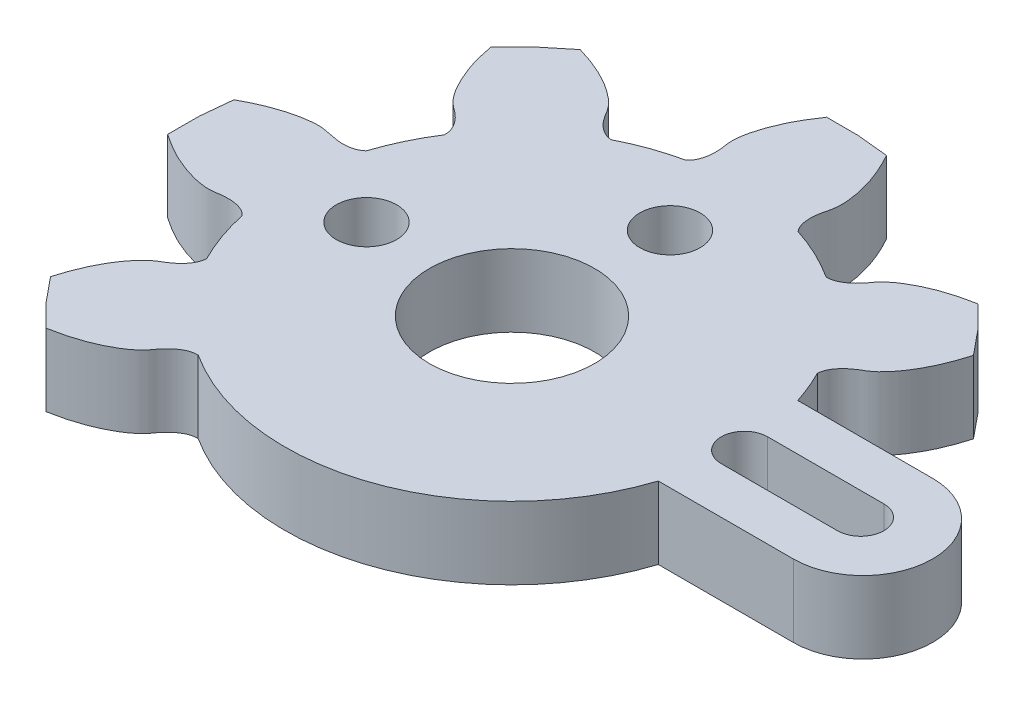
from build123d import *

# Parameters (mm, degrees)
SKETCH1_R           = 3.621001495
SKETCH1_R_2         = 1.32485
BOSS_EXTRUDE8_DEPTH = 3.175


with BuildPart() as part:
    # Sketch1 → Boss-Extrude8 (new body)
    with BuildSketch(Plane(origin=(0, 0, 0), x_dir=(1, 0, 0), z_dir=(0, 1, 0))):
        with BuildLine():
            Line((15.40195, -3.06005), (9.479044209, -3.06005))
            ThreePointArc((9.479044209, -3.06005), (3.349061232, -9.380830133), (-5.397926317, -8.371294798))
            add(Edge.make_bspline(
                [(-5.39885, -8.37085), (-5.398388066, -8.371072444), (-5.397926317, -8.371294798)],
                knots=[0.982532751, 0.982532751, 0.982532751, 0.982534494, 0.982534494, 0.982534494], degree=2))
            add(Edge.make_bspline(
                [(-9.76365, -10.68465), (-9.66975, -10.666225), (-9.57585, -10.6478), (-9.48195, -10.629375), (-9.461309709, -10.625324975), (-9.420029127, -10.617224924), (-9.358357661, -10.603714532), (-9.317485887, -10.593754844), (-9.29705, -10.588775), (-9.236383333, -10.573991667), (-9.175716667, -10.559208333), (-9.11505, -10.544425), (-9.09505359, -10.539552248), (-9.055060769, -10.529806745), (-8.995386219, -10.513820435), (-8.955895406, -10.502206812), (-8.93615, -10.4964), (-8.87755, -10.479166667), (-8.81895, -10.461933333), (-8.76035, -10.4447), (-8.741044573, -10.439022579), (-8.70243372, -10.427667738), (-8.644911698, -10.40922259), (-8.606920566, -10.395940863), (-8.587925, -10.3893), (-8.531575, -10.3696), (-8.475225, -10.3499), (-8.418875, -10.3302), (-8.400307112, -10.323708653), (-8.363171337, -10.31072596), (-8.307945222, -10.289819151), (-8.271548407, -10.274889717), (-8.25335, -10.267425), (-8.19935, -10.245275), (-8.14535, -10.223125), (-8.09135, -10.200975), (-8.07357074, -10.193682211), (-8.038012219, -10.179096633), (-7.985260366, -10.15572195), (-7.950603455, -10.139107317), (-7.933275, -10.1308), (-7.881891667, -10.106166667), (-7.830508333, -10.081533333), (-7.779125, -10.0569), (-7.762209538, -10.048790674), (-7.728378614, -10.032572021), (-7.678342979, -10.006692624), (-7.64559766, -9.988380875), (-7.629225, -9.979225), (-7.580675, -9.952075), (-7.532125, -9.924925), (-7.483575, -9.897775), (-7.467600223, -9.888841628), (-7.435650668, -9.870974884), (-7.388629916, -9.842479544), (-7.358059972, -9.822343181), (-7.342775, -9.812275), (-7.297458333, -9.782425), (-7.252141667, -9.752575), (-7.206825, -9.722725), (-7.191929518, -9.712913375), (-7.162138555, -9.693290126), (-7.118658875, -9.661920653), (-7.090719625, -9.639740218), (-7.07675, -9.62865), (-7.03535, -9.595783333), (-6.99395, -9.562916667), (-6.95255, -9.53005), (-6.938979405, -9.519276564), (-6.911838214, -9.497729693), (-6.873312582, -9.462407671), (-6.849654194, -9.43708589), (-6.837825, -9.424425), (-6.802741667, -9.386875), (-6.767658333, -9.349325), (-6.732575, -9.311775), (-6.720947754, -9.299330256), (-6.697693261, -9.274440768), (-6.66504846, -9.234878404), (-6.645066153, -9.207292801), (-6.635075, -9.1935), (-6.605158333, -9.1522), (-6.575241667, -9.1109), (-6.545325, -9.0696), (-6.535335739, -9.055809811), (-6.515357216, -9.028229432), (-6.482944791, -8.988528925), (-6.459948264, -8.963409642), (-6.44845, -8.95085), (-6.413783333, -8.912983333), (-6.379116667, -8.875116667), (-6.34445, -8.83725), (-6.335737, -8.827732723), (-6.318311001, -8.80869817), (-6.292038918, -8.780084789), (-6.272746306, -8.76294493), (-6.2631, -8.754375), (-6.243533333, -8.736991667), (-6.223966667, -8.719608333), (-6.2044, -8.702225), (-6.197807751, -8.696368343), (-6.184623253, -8.684655028), (-6.164052786, -8.667944781), (-6.149917595, -8.65739826), (-6.14285, -8.652125), (-6.121383333, -8.636108333), (-6.099916667, -8.620091667), (-6.07845, -8.604075), (-6.071148256, -8.598627038), (-6.056544769, -8.587731113), (-6.033747844, -8.572533046), (-6.018132615, -8.563144349), (-6.010325, -8.55845), (-5.986375, -8.54405), (-5.962425, -8.52965), (-5.938475, -8.51525), (-5.932394003, -8.511593785), (-5.92023201, -8.504281355), (-5.901900883, -8.493339339), (-5.889100294, -8.487213113), (-5.8827, -8.48415), (-5.869466667, -8.477816667), (-5.856233333, -8.471483333), (-5.843, -8.46515), (-5.838483389, -8.462988398), (-5.829450167, -8.458665193), (-5.815647927, -8.452689345), (-5.806332642, -8.449013115), (-5.801675, -8.447175), (-5.787358333, -8.441525), (-5.773041667, -8.435875), (-5.758725, -8.430225), (-5.753783147, -8.428274723), (-5.743899441, -8.424374168), (-5.728768726, -8.419261803), (-5.718572909, -8.416270601), (-5.713475, -8.414775), (-5.697625, -8.410125), (-5.681775, -8.405475), (-5.665925, -8.400825), (-5.660342654, -8.399187277), (-5.649177962, -8.395911831), (-5.632104617, -8.39205124), (-5.620651539, -8.390000413), (-5.614925, -8.388975), (-5.596775, -8.385725), (-5.578625, -8.382475), (-5.560475, -8.379225), (-5.553792818, -8.378028466), (-5.540428454, -8.375635398), (-5.520008491, -8.374005169), (-5.506436164, -8.373651723), (-5.49965, -8.373475), (-5.46605, -8.3726), (-5.43245, -8.371725), (-5.39885, -8.37085)],
                knots=[0, 0, 0, 0, 0.056502834, 0.056502834, 0.056502834, 0.068922802, 0.081342769, 0.093762737, 0.093762737, 0.093762737, 0.130633073, 0.130633073, 0.130633073, 0.142785947, 0.154938821, 0.167091696, 0.167091696, 0.167091696, 0.20315874, 0.20315874, 0.20315874, 0.215040816, 0.226922892, 0.238804968, 0.238804968, 0.238804968, 0.27405293, 0.27405293, 0.27405293, 0.285667485, 0.297282041, 0.308896596, 0.308896596, 0.308896596, 0.343360381, 0.343360381, 0.343360381, 0.354707429, 0.366054477, 0.377401525, 0.377401525, 0.377401525, 0.411048445, 0.411048445, 0.411048445, 0.422125056, 0.433201667, 0.444278278, 0.444278278, 0.444278278, 0.477123856, 0.477123856, 0.477123856, 0.487931287, 0.498738719, 0.50954615, 0.50954615, 0.50954615, 0.541587868, 0.541587868, 0.541587868, 0.552119906, 0.562651943, 0.57318398, 0.57318398, 0.57318398, 0.604396439, 0.604396439, 0.604396439, 0.614627638, 0.624858837, 0.635090036, 0.635090036, 0.635090036, 0.665433995, 0.665433995, 0.665433995, 0.675490527, 0.68554706, 0.695603592, 0.695603592, 0.695603592, 0.725716025, 0.725716025, 0.725716025, 0.735770653, 0.745825281, 0.755879909, 0.755879909, 0.755879909, 0.78619409, 0.78619409, 0.78619409, 0.793813151, 0.801432212, 0.809051273, 0.809051273, 0.809051273, 0.824505855, 0.824505855, 0.824505855, 0.829712692, 0.834919529, 0.840126366, 0.840126366, 0.840126366, 0.855941284, 0.855941284, 0.855941284, 0.861320623, 0.866699962, 0.872079301, 0.872079301, 0.872079301, 0.88858052, 0.88858052, 0.88858052, 0.892770243, 0.896959966, 0.901149689, 0.901149689, 0.901149689, 0.909812415, 0.909812415, 0.909812415, 0.912769053, 0.91572569, 0.918682327, 0.918682327, 0.918682327, 0.927770442, 0.927770442, 0.927770442, 0.930907494, 0.934044547, 0.937181599, 0.937181599, 0.937181599, 0.946935064, 0.946935064, 0.946935064, 0.95037022, 0.953805376, 0.957240532, 0.957240532, 0.957240532, 0.968128099, 0.968128099, 0.968128099, 0.972136512, 0.976144926, 0.980153339, 0.980153339, 0.980153339, 1, 1, 1, 1], degree=3))
            Line((-9.76365, -10.68465), (-10.74155, -9.70115))
            Line((-10.74155, -9.70115), (-11.62055, -8.62865))
            add(Edge.make_bspline(
                [(-8.875894683, -4.520473283), (-8.87995, -4.554525), (-8.88425, -4.5879), (-8.88855, -4.621275), (-8.889417644, -4.62800933), (-8.891152932, -4.641477991), (-8.894833157, -4.66163045), (-8.898544386, -4.674693483), (-8.9004, -4.681225), (-8.905433333, -4.698941667), (-8.910466667, -4.716658333), (-8.9155, -4.734375), (-8.917089228, -4.739968872), (-8.920267684, -4.751156617), (-8.925827695, -4.767749798), (-8.930225898, -4.778516599), (-8.932425, -4.7839), (-8.938675, -4.7992), (-8.944925, -4.8145), (-8.951175, -4.8298), (-8.953185758, -4.834722336), (-8.957207274, -4.844567008), (-8.963841786, -4.859108956), (-8.968730595, -4.868552985), (-8.971175, -4.873275), (-8.978258333, -4.886958333), (-8.985341667, -4.900641667), (-8.992425, -4.914325), (-8.994726466, -4.918770891), (-8.999329398, -4.927662673), (-9.006690131, -4.940777083), (-9.011930044, -4.949309028), (-9.01455, -4.953575), (-9.022216667, -4.966058333), (-9.029883333, -4.978541667), (-9.03755, -4.991025), (-9.041261043, -4.997067546), (-9.048683129, -5.009152639), (-9.061395503, -5.026280419), (-9.069881834, -5.037643473), (-9.074125, -5.043325), (-9.090841667, -5.065708333), (-9.107558333, -5.088091667), (-9.124275, -5.110475), (-9.129726551, -5.117774535), (-9.140629654, -5.132373605), (-9.158063981, -5.153516152), (-9.17040466, -5.166922051), (-9.176575, -5.173625), (-9.194725, -5.193341667), (-9.212875, -5.213058333), (-9.231025, -5.232775), (-9.236997994, -5.239263569), (-9.248943981, -5.252240707), (-9.267657405, -5.271008071), (-9.280635802, -5.28295269), (-9.287125, -5.288925), (-9.306375, -5.306641667), (-9.325625, -5.324358333), (-9.344875, -5.342075), (-9.354366518, -5.350810484), (-9.373349555, -5.368281452), (-9.404488924, -5.3914928), (-9.425196308, -5.406880933), (-9.43555, -5.414575), (-9.47675, -5.445191667), (-9.51795, -5.475808333), (-9.55915, -5.506425), (-9.572818003, -5.516582007), (-9.600154008, -5.536896021), (-9.642939104, -5.565109828), (-9.672396368, -5.582203276), (-9.687125, -5.59075), (-9.731241667, -5.61635), (-9.775358333, -5.64195), (-9.819475, -5.66755), (-9.834207417, -5.676098921), (-9.863672251, -5.693196762), (-9.906346122, -5.721657481), (-9.933482041, -5.742252494), (-9.94705, -5.75255), (-9.987983333, -5.783616667), (-10.028916667, -5.814683333), (-10.06985, -5.84575), (-10.083652948, -5.856225853), (-10.111258845, -5.87717756), (-10.150311323, -5.911928124), (-10.174487108, -5.936759375), (-10.186575, -5.949175), (-10.223458333, -5.987058333), (-10.260341667, -6.024941667), (-10.297225, -6.062825), (-10.309669163, -6.075606556), (-10.33455749, -6.101169668), (-10.370180135, -6.14124456), (-10.392743378, -6.16888152), (-10.404025, -6.1827), (-10.438341667, -6.224733333), (-10.472658333, -6.266766667), (-10.506975, -6.3088), (-10.518549041, -6.322976655), (-10.541697123, -6.351329964), (-10.574818781, -6.395210772), (-10.595822927, -6.425186924), (-10.606325, -6.440175), (-10.638241667, -6.485725), (-10.670158333, -6.531275), (-10.702075, -6.576825), (-10.712838738, -6.592186513), (-10.734366215, -6.622909538), (-10.765177447, -6.670062206), (-10.784742482, -6.702070735), (-10.794525, -6.718075), (-10.824241667, -6.766691667), (-10.853958333, -6.815308333), (-10.883675, -6.863925), (-10.893695201, -6.880318116), (-10.913735602, -6.913104348), (-10.942341843, -6.963198589), (-10.960463948, -6.997082863), (-10.969525, -7.014025), (-10.997041667, -7.065475), (-11.024558333, -7.116925), (-11.052075, -7.168375), (-11.061352149, -7.185721189), (-11.079906446, -7.220413566), (-11.10631741, -7.273233713), (-11.123005803, -7.308861238), (-11.13135, -7.326675), (-11.156683333, -7.380758333), (-11.182016667, -7.434841667), (-11.20735, -7.488925), (-11.21588754, -7.507151525), (-11.232962621, -7.543604576), (-11.257171761, -7.598960897), (-11.272407254, -7.636220299), (-11.280025, -7.65485), (-11.303141667, -7.711383333), (-11.326258333, -7.767916667), (-11.349375, -7.82445), (-11.35716434, -7.843499344), (-11.372743019, -7.881598031), (-11.394716866, -7.93933363), (-11.408472289, -7.978127877), (-11.41535, -7.997525), (-11.436216667, -8.056375), (-11.457083333, -8.115225), (-11.47795, -8.174075), (-11.484979805, -8.19390107), (-11.499039414, -8.233553211), (-11.518728382, -8.293544353), (-11.530959461, -8.333798118), (-11.537075, -8.353925), (-11.5649, -8.4455), (-11.592725, -8.537075), (-11.62055, -8.62865)],
                knots=[0, 0, 0, 0, 0.019869495, 0.019869495, 0.019869495, 0.023878716, 0.027887937, 0.031897157, 0.031897157, 0.031897157, 0.042772125, 0.042772125, 0.042772125, 0.046205794, 0.049639464, 0.053073133, 0.053073133, 0.053073133, 0.062831861, 0.062831861, 0.062831861, 0.065971451, 0.069111042, 0.072250633, 0.072250633, 0.072250633, 0.081348457, 0.081348457, 0.081348457, 0.084304458, 0.087260458, 0.090216458, 0.090216458, 0.090216458, 0.098866476, 0.098866476, 0.098866476, 0.103053509, 0.107240543, 0.111427576, 0.111427576, 0.111427576, 0.127923099, 0.127923099, 0.127923099, 0.133302532, 0.138681965, 0.144061399, 0.144061399, 0.144061399, 0.159884954, 0.159884954, 0.159884954, 0.165092337, 0.17029972, 0.175507102, 0.175507102, 0.175507102, 0.190954637, 0.190954637, 0.190954637, 0.19857129, 0.206187942, 0.213804595, 0.213804595, 0.213804595, 0.244113211, 0.244113211, 0.244113211, 0.254168023, 0.264222835, 0.274277647, 0.274277647, 0.274277647, 0.304394822, 0.304394822, 0.304394822, 0.314452218, 0.324509614, 0.334567011, 0.334567011, 0.334567011, 0.364909285, 0.364909285, 0.364909285, 0.37514087, 0.385372454, 0.395604038, 0.395604038, 0.395604038, 0.426823289, 0.426823289, 0.426823289, 0.437356433, 0.447889577, 0.458422721, 0.458422721, 0.458422721, 0.490462652, 0.490462652, 0.490462652, 0.501268815, 0.512074978, 0.522881141, 0.522881141, 0.522881141, 0.555721961, 0.555721961, 0.555721961, 0.566797365, 0.57787277, 0.588948175, 0.588948175, 0.588948175, 0.622592285, 0.622592285, 0.622592285, 0.633936786, 0.645281287, 0.656625788, 0.656625788, 0.656625788, 0.691076847, 0.691076847, 0.691076847, 0.702691901, 0.714306956, 0.725922011, 0.725922011, 0.725922011, 0.761185807, 0.761185807, 0.761185807, 0.773069995, 0.784954182, 0.796838369, 0.796838369, 0.796838369, 0.832901897, 0.832901897, 0.832901897, 0.845053781, 0.857205665, 0.86935755, 0.86935755, 0.86935755, 0.90622582, 0.90622582, 0.90622582, 0.918646431, 0.931067041, 0.943487651, 0.943487651, 0.943487651, 1, 1, 1, 1], degree=3))
            ThreePointArc((-8.875894683, -4.520473283), (-9.384335902, -3.339225181), (-9.73665, -2.10145))
            add(Edge.make_bspline(
                [(-14.45905, -0.65115), (-14.37965, -0.70455), (-14.30025, -0.75795), (-14.22085, -0.81135), (-14.203394477, -0.823089608), (-14.168483432, -0.846568825), (-14.115322064, -0.880637287), (-14.079374021, -0.902495762), (-14.0614, -0.913425), (-14.008033333, -0.945875), (-13.954666667, -0.978325), (-13.9013, -1.010775), (-13.883715092, -1.021467635), (-13.848545276, -1.042852904), (-13.795040106, -1.073732233), (-13.758896702, -1.093427411), (-13.740825, -1.103275), (-13.687208333, -1.132491667), (-13.633591667, -1.161708333), (-13.579975, -1.190925), (-13.562302674, -1.200554962), (-13.526958023, -1.219814885), (-13.473231796, -1.247444376), (-13.436977265, -1.264931459), (-13.41885, -1.273675), (-13.36505, -1.299625), (-13.31125, -1.325575), (-13.25745, -1.351525), (-13.239731987, -1.360071142), (-13.204295962, -1.377163425), (-13.15045571, -1.401431733), (-13.114151903, -1.416593911), (-13.096, -1.424175), (-13.042166667, -1.446658333), (-12.988333333, -1.469141667), (-12.9345, -1.491625), (-12.916773161, -1.499028562), (-12.881319483, -1.513835687), (-12.827506655, -1.534597035), (-12.791268885, -1.547365678), (-12.77315, -1.55375), (-12.719416667, -1.572683333), (-12.665683333, -1.591616667), (-12.61195, -1.61055), (-12.594259204, -1.616783482), (-12.558877611, -1.629250445), (-12.505203027, -1.646333345), (-12.469101009, -1.656527782), (-12.45105, -1.661625), (-12.397516667, -1.676741667), (-12.343983333, -1.691858333), (-12.29045, -1.706975), (-12.272835198, -1.711949043), (-12.237605594, -1.721897128), (-12.184206346, -1.73499493), (-12.148352115, -1.742381643), (-12.130425, -1.746075), (-12.077275, -1.757025), (-12.024125, -1.767975), (-11.970975, -1.778925), (-11.953504341, -1.782524317), (-11.918563023, -1.789722952), (-11.865636121, -1.798300758), (-11.830195374, -1.802383586), (-11.812475, -1.804425), (-11.759958333, -1.810475), (-11.707441667, -1.816525), (-11.654925, -1.822575), (-11.637710255, -1.824558165), (-11.603280765, -1.828524495), (-11.551055081, -1.830786904), (-11.51641836, -1.829595635), (-11.4991, -1.829), (-11.447733333, -1.827233333), (-11.396366667, -1.825466667), (-11.345, -1.8237), (-11.327976022, -1.82311449), (-11.293928067, -1.82194347), (-11.242864274, -1.817048901), (-11.209221425, -1.811682967), (-11.1924, -1.809), (-11.142033333, -1.800966667), (-11.091666667, -1.792933333), (-11.0413, -1.7849), (-11.024484131, -1.782217919), (-10.990852393, -1.776853757), (-10.939860428, -1.77170571), (-10.905836809, -1.770201903), (-10.888825, -1.76945), (-10.837541667, -1.767183333), (-10.786258333, -1.764916667), (-10.734975, -1.76265), (-10.722089804, -1.762080489), (-10.696319413, -1.760941466), (-10.657525274, -1.759281162), (-10.631775091, -1.760810387), (-10.6189, -1.761575), (-10.5928, -1.763125), (-10.5667, -1.764675), (-10.5406, -1.766225), (-10.531794763, -1.766747916), (-10.51418429, -1.767793749), (-10.487815672, -1.770518547), (-10.470355224, -1.773039516), (-10.461625, -1.7743), (-10.435075, -1.778133333), (-10.408525, -1.781966667), (-10.381975, -1.7858), (-10.372956183, -1.787102152), (-10.354918548, -1.789706456), (-10.328042911, -1.795083283), (-10.310364304, -1.799511094), (-10.301525, -1.801725), (-10.274441667, -1.808508333), (-10.247358333, -1.815291667), (-10.220275, -1.822075), (-10.213395854, -1.823797961), (-10.199637563, -1.827243884), (-10.178961886, -1.832490136), (-10.165570629, -1.837163379), (-10.158875, -1.8395), (-10.145025, -1.844333333), (-10.131175, -1.849166667), (-10.117325, -1.854), (-10.11259695, -1.855649981), (-10.103140851, -1.858949944), (-10.08914779, -1.864474812), (-10.07996593, -1.868474937), (-10.075375, -1.870475), (-10.061258333, -1.876625), (-10.047141667, -1.882775), (-10.033025, -1.888925), (-10.028152778, -1.891047609), (-10.018408333, -1.895292828), (-10.004093681, -1.902384772), (-9.99476456, -1.907478257), (-9.9901, -1.910025), (-9.9756, -1.917941667), (-9.9611, -1.925858333), (-9.9466, -1.933775), (-9.94149644, -1.936561426), (-9.931289321, -1.942134279), (-9.916499605, -1.951484217), (-9.906966535, -1.958144739), (-9.9022, -1.961475), (-9.8871, -1.972025), (-9.872, -1.982575), (-9.8569, -1.993125), (-9.851336658, -1.997011971), (-9.840209973, -2.004785913), (-9.824627688, -2.018069507), (-9.814775896, -2.027406502), (-9.80985, -2.032075), (-9.78545, -2.0552), (-9.76105, -2.078325), (-9.73665, -2.10145)],
                knots=[0, 0, 0, 0, 0.056501117, 0.056501117, 0.056501117, 0.068922484, 0.081343851, 0.093765217, 0.093765217, 0.093765217, 0.130645498, 0.130645498, 0.130645498, 0.142797959, 0.15495042, 0.167102881, 0.167102881, 0.167102881, 0.203157839, 0.203157839, 0.203157839, 0.215041736, 0.226925633, 0.23880953, 0.23880953, 0.23880953, 0.274079808, 0.274079808, 0.274079808, 0.285695407, 0.297311005, 0.308926604, 0.308926604, 0.308926604, 0.343375135, 0.343375135, 0.343375135, 0.354718731, 0.366062326, 0.377405922, 0.377405922, 0.377405922, 0.411046469, 0.411046469, 0.411046469, 0.422122053, 0.433197638, 0.444273222, 0.444273222, 0.444273222, 0.477119748, 0.477119748, 0.477119748, 0.487927688, 0.498735628, 0.509543569, 0.509543569, 0.509543569, 0.541586761, 0.541586761, 0.541586761, 0.552119512, 0.562652263, 0.573185013, 0.573185013, 0.573185013, 0.60440021, 0.60440021, 0.60440021, 0.614632422, 0.624864634, 0.635096846, 0.635096846, 0.635096846, 0.665445828, 0.665445828, 0.665445828, 0.67550411, 0.685562391, 0.695620673, 0.695620673, 0.695620673, 0.725737154, 0.725737154, 0.725737154, 0.735792114, 0.745847074, 0.755902033, 0.755902033, 0.755902033, 0.786213439, 0.786213439, 0.786213439, 0.793829332, 0.801445225, 0.809061118, 0.809061118, 0.809061118, 0.824499829, 0.824499829, 0.824499829, 0.829708316, 0.834916803, 0.840125289, 0.840125289, 0.840125289, 0.855965126, 0.855965126, 0.855965126, 0.861345788, 0.866726451, 0.872107114, 0.872107114, 0.872107114, 0.888593286, 0.888593286, 0.888593286, 0.892780761, 0.896968236, 0.90115571, 0.90115571, 0.90115571, 0.90981756, 0.90981756, 0.90981756, 0.912774502, 0.915731445, 0.918688387, 0.918688387, 0.918688387, 0.9277807, 0.9277807, 0.9277807, 0.930918818, 0.934056936, 0.937195055, 0.937195055, 0.937195055, 0.946950039, 0.946950039, 0.946950039, 0.950383498, 0.953816956, 0.957250415, 0.957250415, 0.957250415, 0.968127335, 0.968127335, 0.968127335, 0.972134755, 0.976142174, 0.980149594, 0.980149594, 0.980149594, 1, 1, 1, 1], degree=3))
            Line((-14.45905, -0.65115), (-14.45515, 0.73555))
            Line((-14.45515, 0.73555), (-14.31835, 2.11575))
            add(Edge.make_bspline(
                [(-9.47275279, 3.079470686), (-9.499575, 3.058525), (-9.5262, 3.038), (-9.552825, 3.017475), (-9.558201134, 3.013330581), (-9.568953403, 3.005041743), (-9.585808694, 2.993408616), (-9.597669565, 2.986802872), (-9.6036, 2.9835), (-9.6197, 2.974533333), (-9.6358, 2.965566667), (-9.6519, 2.9566), (-9.656982608, 2.953769313), (-9.667147825, 2.94810794), (-9.682825385, 2.940313965), (-9.693558462, 2.935821322), (-9.698925, 2.933575), (-9.714175, 2.927191667), (-9.729425, 2.920808333), (-9.744675, 2.914425), (-9.749577525, 2.912372905), (-9.759382574, 2.908268715), (-9.774343121, 2.902670637), (-9.784464374, 2.899423546), (-9.789525, 2.8978), (-9.804175, 2.8931), (-9.818825, 2.8884), (-9.833475, 2.8837), (-9.838241417, 2.882170842), (-9.847774251, 2.879112527), (-9.862245855, 2.875022488), (-9.871981952, 2.872690829), (-9.87685, 2.871525), (-9.891116667, 2.868108333), (-9.905383333, 2.864691667), (-9.91965, 2.861275), (-9.926549058, 2.859622772), (-9.940347174, 2.856318317), (-9.961460041, 2.853209675), (-9.975503347, 2.851186558), (-9.982525, 2.850175), (-10.010175, 2.846191667), (-10.037825, 2.842208333), (-10.065475, 2.838225), (-10.074494103, 2.836925684), (-10.09253231, 2.834327051), (-10.119812799, 2.831705712), (-10.138020933, 2.830935237), (-10.147125, 2.83055), (-10.173908333, 2.829416667), (-10.200691667, 2.828283333), (-10.227475, 2.82715), (-10.236283786, 2.826777257), (-10.253901357, 2.826031772), (-10.280398425, 2.825986947), (-10.298016142, 2.826728982), (-10.306825, 2.8271), (-10.332941667, 2.8282), (-10.359058333, 2.8293), (-10.385175, 2.8304), (-10.398061977, 2.830942783), (-10.42383593, 2.832028348), (-10.462264313, 2.837610268), (-10.487788104, 2.841353423), (-10.50055, 2.843225), (-10.55135, 2.850675), (-10.60215, 2.858125), (-10.65295, 2.865575), (-10.669799441, 2.86804603), (-10.703498322, 2.872988091), (-10.753708799, 2.883294584), (-10.7866196, 2.892064861), (-10.803075, 2.89645), (-10.852358333, 2.909583333), (-10.901641667, 2.922716667), (-10.950925, 2.93585), (-10.967383318, 2.940235916), (-11.000299955, 2.949007749), (-11.050598624, 2.959073052), (-11.084349541, 2.963691017), (-11.101225, 2.966), (-11.152141667, 2.972966667), (-11.203058333, 2.979933333), (-11.253975, 2.9869), (-11.271143929, 2.989249137), (-11.305481787, 2.99394741), (-11.35766766, 2.996996903), (-11.392322553, 2.996548968), (-11.40965, 2.996325), (-11.462516667, 2.995641667), (-11.515383333, 2.994958333), (-11.56825, 2.994275), (-11.586086477, 2.994044453), (-11.621759431, 2.993583359), (-11.675285043, 2.990432825), (-11.710778348, 2.986827608), (-11.728525, 2.985025), (-11.782508333, 2.979541667), (-11.836491667, 2.974058333), (-11.890475, 2.968575), (-11.908680212, 2.966725814), (-11.945090636, 2.963027441), (-11.999530576, 2.955419235), (-12.035576859, 2.949089745), (-12.0536, 2.945925), (-12.108366667, 2.936308333), (-12.163133333, 2.926691667), (-12.2179, 2.917075), (-12.236374347, 2.913831026), (-12.27332304, 2.907343079), (-12.328452438, 2.895788641), (-12.364917479, 2.886979547), (-12.38315, 2.882575), (-12.43855, 2.869191667), (-12.49395, 2.855808333), (-12.54935, 2.842425), (-12.568029735, 2.837912417), (-12.605389205, 2.82888725), (-12.661049299, 2.813687425), (-12.6978331, 2.802545808), (-12.716225, 2.796975), (-12.772075, 2.780058333), (-12.827925, 2.763141667), (-12.883775, 2.746225), (-12.902598938, 2.74052333), (-12.940246813, 2.72911999), (-12.996266796, 2.710456362), (-13.033255599, 2.697068787), (-13.05175, 2.690375), (-13.107883333, 2.670058333), (-13.164016667, 2.649741667), (-13.22015, 2.629425), (-13.239074472, 2.622575555), (-13.276923415, 2.608876665), (-13.333179405, 2.586846768), (-13.370293135, 2.571265589), (-13.38885, 2.563475), (-13.445183333, 2.539825), (-13.501516667, 2.516175), (-13.55785, 2.492525), (-13.576826936, 2.484558055), (-13.614780809, 2.468624166), (-13.671141253, 2.443322848), (-13.708297084, 2.425607616), (-13.726875, 2.41675), (-13.783225, 2.389883333), (-13.839575, 2.363016667), (-13.895925, 2.33615), (-13.914912623, 2.327097043), (-13.95288787, 2.308991128), (-14.009235442, 2.280507419), (-14.046361814, 2.26071914), (-14.064925, 2.250825), (-14.1494, 2.2058), (-14.233875, 2.160775), (-14.31835, 2.11575)],
                knots=[0, 0, 0, 0, 0.019850356, 0.019850356, 0.019850356, 0.02385855, 0.027866745, 0.031874939, 0.031874939, 0.031874939, 0.042756422, 0.042756422, 0.042756422, 0.046191597, 0.049626772, 0.053061947, 0.053061947, 0.053061947, 0.062823624, 0.062823624, 0.062823624, 0.065961779, 0.069099934, 0.072238089, 0.072238089, 0.072238089, 0.081322729, 0.081322729, 0.081322729, 0.084278441, 0.087234153, 0.090189865, 0.090189865, 0.090189865, 0.098852096, 0.098852096, 0.098852096, 0.103040968, 0.107229839, 0.111418711, 0.111418711, 0.111418711, 0.12791373, 0.12791373, 0.12791373, 0.13329421, 0.138674691, 0.144055171, 0.144055171, 0.144055171, 0.159884052, 0.159884052, 0.159884052, 0.165090022, 0.170295992, 0.175501962, 0.175501962, 0.175501962, 0.190936717, 0.190936717, 0.190936717, 0.198552824, 0.206168932, 0.213785039, 0.213785039, 0.213785039, 0.244101714, 0.244101714, 0.244101714, 0.254157207, 0.264212699, 0.274268192, 0.274268192, 0.274268192, 0.304384031, 0.304384031, 0.304384031, 0.314441307, 0.324498583, 0.334555858, 0.334555858, 0.334555858, 0.36490069, 0.36490069, 0.36490069, 0.375132866, 0.385365041, 0.395597217, 0.395597217, 0.395597217, 0.426815954, 0.426815954, 0.426815954, 0.437348721, 0.447881489, 0.458414256, 0.458414256, 0.458414256, 0.490453757, 0.490453757, 0.490453757, 0.501258683, 0.512063608, 0.522868534, 0.522868534, 0.522868534, 0.55570131, 0.55570131, 0.55570131, 0.566776735, 0.57785216, 0.588927584, 0.588927584, 0.588927584, 0.622580557, 0.622580557, 0.622580557, 0.633927644, 0.64527473, 0.656621817, 0.656621817, 0.656621817, 0.691079094, 0.691079094, 0.691079094, 0.702692731, 0.714306368, 0.725920005, 0.725920005, 0.725920005, 0.761169167, 0.761169167, 0.761169167, 0.773052869, 0.78493657, 0.796820271, 0.796820271, 0.796820271, 0.832895789, 0.832895789, 0.832895789, 0.845048501, 0.857201213, 0.869353926, 0.869353926, 0.869353926, 0.906215184, 0.906215184, 0.906215184, 0.918635905, 0.931056627, 0.943477349, 0.943477349, 0.943477349, 1, 1, 1, 1], degree=3))
            ThreePointArc((-9.47275279, 3.079470686), (-8.997092109, 4.274168774), (-8.371484108, 5.397632718))
            Line((-8.371484108, 5.397632718), (-8.37085, 5.39895))
            add(Edge.make_bspline(
                [(-10.68455, 9.76365), (-10.66615, 9.66975), (-10.64775, 9.57585), (-10.62935, 9.48195), (-10.625305496, 9.46130984), (-10.617216487, 9.420029519), (-10.603722787, 9.358358062), (-10.593774262, 9.317486021), (-10.5888, 9.29705), (-10.574033333, 9.236383333), (-10.559266667, 9.175716667), (-10.5445, 9.11505), (-10.539633363, 9.095056139), (-10.529900088, 9.055068418), (-10.513897752, 8.995408534), (-10.502249251, 8.955936178), (-10.496425, 8.9362), (-10.479141667, 8.877633333), (-10.461858333, 8.819066667), (-10.444575, 8.7605), (-10.438878962, 8.741198286), (-10.427486886, 8.702594857), (-10.40902376, 8.645075426), (-10.39575792, 8.607075142), (-10.389125, 8.588075), (-10.369441667, 8.531691667), (-10.349758333, 8.475308333), (-10.330075, 8.418925), (-10.323590254, 8.400349304), (-10.310620761, 8.363197912), (-10.28971449, 8.307953721), (-10.274771497, 8.27155124), (-10.2673, 8.25335), (-10.245133333, 8.19935), (-10.222966667, 8.14535), (-10.2008, 8.09135), (-10.193502514, 8.073572667), (-10.178907543, 8.038018001), (-10.155533236, 7.985266938), (-10.138927745, 7.950605646), (-10.130625, 7.933275), (-10.106008333, 7.881891667), (-10.081391667, 7.830508333), (-10.056775, 7.779125), (-10.048671754, 7.762210776), (-10.032465261, 7.728382329), (-10.006594324, 7.678354157), (-9.988281441, 7.645618052), (-9.979125, 7.62925), (-9.951975, 7.580716667), (-9.924825, 7.532183333), (-9.897675, 7.48365), (-9.888740451, 7.467678602), (-9.870871352, 7.435735805), (-9.842375626, 7.388723968), (-9.822241875, 7.358157989), (-9.812175, 7.342875), (-9.782325, 7.297558333), (-9.752475, 7.252241667), (-9.722625, 7.206925), (-9.712812137, 7.192027639), (-9.693186412, 7.162232916), (-9.661816636, 7.118745685), (-9.639638879, 7.090798562), (-9.62855, 7.076825), (-9.595683333, 7.035408333), (-9.562816667, 6.993991667), (-9.52995, 6.952575), (-9.519178055, 6.939000819), (-9.497634164, 6.911852458), (-9.462303061, 6.873324019), (-9.436967687, 6.849674673), (-9.4243, 6.83785), (-9.386733333, 6.802783333), (-9.349166667, 6.767716667), (-9.3116, 6.73265), (-9.299149927, 6.721028459), (-9.274249782, 6.697785378), (-9.234689719, 6.665142344), (-9.20711324, 6.645147448), (-9.193325, 6.63515), (-9.152041667, 6.605216667), (-9.110758333, 6.575283333), (-9.069475, 6.54535), (-9.05568795, 6.535353415), (-9.028113849, 6.515360244), (-8.988415371, 6.482940089), (-8.963288457, 6.459946696), (-8.950725, 6.44845), (-8.912841667, 6.413783333), (-8.874958333, 6.379116667), (-8.837075, 6.34445), (-8.827555814, 6.335739086), (-8.808517442, 6.318317259), (-8.779896004, 6.292051159), (-8.762765335, 6.272750386), (-8.7542, 6.2631), (-8.736833333, 6.243533333), (-8.719466667, 6.223966667), (-8.7021, 6.2044), (-8.696246483, 6.197804963), (-8.684539449, 6.184614888), (-8.66783035, 6.164044897), (-8.657276783, 6.149914966), (-8.652, 6.14285), (-8.635966667, 6.121383333), (-8.619933333, 6.099916667), (-8.6039, 6.07845), (-8.598449323, 6.071152212), (-8.587547968, 6.056556635), (-8.572356695, 6.033758261), (-8.562985565, 6.018136087), (-8.5583, 6.010325), (-8.543933333, 5.986375), (-8.529566667, 5.962425), (-8.5152, 5.938475), (-8.511551255, 5.932392347), (-8.504253765, 5.920227042), (-8.493334921, 5.901895923), (-8.487178307, 5.889115308), (-8.4841, 5.882725), (-8.477733333, 5.869508333), (-8.471366667, 5.856291667), (-8.465, 5.843075), (-8.462826451, 5.838562895), (-8.458479354, 5.829538686), (-8.452495939, 5.81573375), (-8.44883198, 5.80641125), (-8.447, 5.80175), (-8.441366667, 5.787416667), (-8.435733333, 5.773083333), (-8.4301, 5.75875), (-8.428155701, 5.753802967), (-8.424267103, 5.743908901), (-8.419153831, 5.728771941), (-8.416151277, 5.71857398), (-8.41465, 5.713475), (-8.409983333, 5.697625), (-8.405316667, 5.681775), (-8.40065, 5.665925), (-8.399007229, 5.660345446), (-8.395721687, 5.649186337), (-8.391879697, 5.632109064), (-8.389859899, 5.620653021), (-8.38885, 5.614925), (-8.38565, 5.596775), (-8.38245, 5.578625), (-8.37925, 5.560475), (-8.378071886, 5.553792883), (-8.375715657, 5.540428649), (-8.374095448, 5.520023225), (-8.373731816, 5.506457742), (-8.37355, 5.499675), (-8.37265, 5.4661), (-8.37175, 5.432525), (-8.37085, 5.39895)],
                knots=[0, 0, 0, 0, 0.056501366, 0.056501366, 0.056501366, 0.068920931, 0.081340497, 0.093760063, 0.093760063, 0.093760063, 0.130628966, 0.130628966, 0.130628966, 0.142779818, 0.15493067, 0.167081523, 0.167081523, 0.167081523, 0.203138905, 0.203138905, 0.203138905, 0.215022273, 0.226905642, 0.23878901, 0.23878901, 0.23878901, 0.274053164, 0.274053164, 0.274053164, 0.285671069, 0.297288974, 0.308906878, 0.308906878, 0.308906878, 0.343375236, 0.343375236, 0.343375236, 0.354722559, 0.366069883, 0.377417206, 0.377417206, 0.377417206, 0.411060691, 0.411060691, 0.411060691, 0.42213536, 0.433210029, 0.444284698, 0.444284698, 0.444284698, 0.477122484, 0.477122484, 0.477122484, 0.487928776, 0.498735067, 0.509541359, 0.509541359, 0.509541359, 0.541583855, 0.541583855, 0.541583855, 0.552117477, 0.562651099, 0.573184721, 0.573184721, 0.573184721, 0.604405646, 0.604405646, 0.604405646, 0.614638205, 0.624870764, 0.635103323, 0.635103323, 0.635103323, 0.665448493, 0.665448493, 0.665448493, 0.67550527, 0.685562047, 0.695618823, 0.695618823, 0.695618823, 0.725729793, 0.725729793, 0.725729793, 0.735785702, 0.745841612, 0.755897521, 0.755897521, 0.755897521, 0.786219697, 0.786219697, 0.786219697, 0.793838943, 0.801458189, 0.809077435, 0.809077435, 0.809077435, 0.824525858, 0.824525858, 0.824525858, 0.829732821, 0.834939785, 0.840146749, 0.840146749, 0.840146749, 0.855967937, 0.855967937, 0.855967937, 0.861346494, 0.866725051, 0.872103608, 0.872103608, 0.872103608, 0.888595095, 0.888595095, 0.888595095, 0.892783487, 0.896971879, 0.901160271, 0.901160271, 0.901160271, 0.909822856, 0.909822856, 0.909822856, 0.91278022, 0.915737583, 0.918694947, 0.918694947, 0.918694947, 0.927788833, 0.927788833, 0.927788833, 0.930927514, 0.934066194, 0.937204875, 0.937204875, 0.937204875, 0.946961353, 0.946961353, 0.946961353, 0.950395851, 0.953830349, 0.957264847, 0.957264847, 0.957264847, 0.968147514, 0.968147514, 0.968147514, 0.972154084, 0.976160654, 0.980167224, 0.980167224, 0.980167224, 1, 1, 1, 1], degree=3))
            Line((-10.68455, 9.76365), (-9.70105, 10.74145))
            Line((-9.70105, 10.74145), (-8.62845, 11.62065))
            add(Edge.make_bspline(
                [(-4.52115, 8.87555), (-4.554475, 8.87985), (-4.5878, 8.88415), (-4.621125, 8.88845), (-4.627857534, 8.889318714), (-4.641322601, 8.891056142), (-4.661468521, 8.894755292), (-4.67452284, 8.898485097), (-4.68105, 8.90035), (-4.698783333, 8.905416667), (-4.716516667, 8.910483333), (-4.73425, 8.91555), (-4.739845752, 8.917148786), (-4.751037256, 8.920346359), (-4.767637504, 8.925922673), (-4.778412501, 8.930324224), (-4.7838, 8.932525), (-4.7991, 8.938775), (-4.8144, 8.945025), (-4.8297, 8.951275), (-4.834618925, 8.953284365), (-4.844456775, 8.957303095), (-4.858990372, 8.963928436), (-4.868430124, 8.968809479), (-4.87315, 8.97125), (-4.886816667, 8.978316667), (-4.900483333, 8.985383333), (-4.91415, 8.99245), (-4.918596688, 8.994749263), (-4.927490064, 8.999347789), (-4.940610935, 9.006693235), (-4.949153645, 9.011914412), (-4.953425, 9.014525), (-4.965941667, 9.022175), (-4.978458333, 9.029825), (-4.990975, 9.037475), (-4.997028839, 9.041175016), (-5.009136516, 9.048575048), (-5.026262854, 9.061316184), (-5.037620951, 9.069822061), (-5.0433, 9.074075), (-5.065666667, 9.090825), (-5.088033333, 9.107575), (-5.1104, 9.124325), (-5.11769066, 9.129784846), (-5.132271981, 9.140704539), (-5.153403931, 9.158136748), (-5.166817977, 9.170462249), (-5.173525, 9.176625), (-5.193241667, 9.194741667), (-5.212958333, 9.212858333), (-5.232675, 9.230975), (-5.239166146, 9.236939392), (-5.252148438, 9.248868176), (-5.270916046, 9.267566071), (-5.282855349, 9.28053869), (-5.288825, 9.287025), (-5.306541667, 9.306275), (-5.324258333, 9.325525), (-5.341975, 9.344775), (-5.350713128, 9.354269391), (-5.368189384, 9.373258173), (-5.391408735, 9.404406068), (-5.406802912, 9.425118689), (-5.4145, 9.435475), (-5.445133333, 9.476691667), (-5.475766667, 9.517908333), (-5.5064, 9.559125), (-5.516558394, 9.572792958), (-5.536875181, 9.600128875), (-5.565083625, 9.642922559), (-5.582161208, 9.672390853), (-5.5907, 9.687125), (-5.616266667, 9.731241667), (-5.641833333, 9.775358333), (-5.6674, 9.819475), (-5.675941748, 9.834214249), (-5.693025245, 9.863692746), (-5.721490245, 9.9063755), (-5.742096748, 9.9335085), (-5.7524, 9.947075), (-5.7835, 9.988025), (-5.8146, 10.028975), (-5.8457, 10.069925), (-5.856181533, 10.083726247), (-5.877144599, 10.111328741), (-5.911889616, 10.150390586), (-5.936713205, 10.174580195), (-5.949125, 10.186675), (-5.986975, 10.223558333), (-6.024825, 10.260441667), (-6.062675, 10.297325), (-6.075446947, 10.309770759), (-6.100990842, 10.334662278), (-6.141060302, 10.370268863), (-6.168703434, 10.392806288), (-6.182525, 10.404075), (-6.224575, 10.438358333), (-6.266625, 10.472641667), (-6.308675, 10.506925), (-6.322859408, 10.518489537), (-6.351228225, 10.541618612), (-6.395106661, 10.574738989), (-6.425068887, 10.595762996), (-6.44005, 10.606275), (-6.485583333, 10.638225), (-6.531116667, 10.670175), (-6.57665, 10.702125), (-6.592006867, 10.712900664), (-6.622720601, 10.734451992), (-6.669874941, 10.76528001), (-6.701891647, 10.784843337), (-6.7179, 10.794625), (-6.766533333, 10.824341667), (-6.815166667, 10.854058333), (-6.8638, 10.883775), (-6.880197583, 10.893794496), (-6.912992748, 10.913833489), (-6.963103972, 10.942431624), (-6.997001324, 10.960543875), (-7.01395, 10.9696), (-7.065416667, 10.9971), (-7.116883333, 11.0246), (-7.16835, 11.0521), (-7.185699774, 11.061370443), (-7.220399321, 11.079911328), (-7.273218007, 11.106322577), (-7.308839336, 11.123024192), (-7.32665, 11.131375), (-7.380716667, 11.156725), (-7.434783333, 11.182075), (-7.48885, 11.207425), (-7.507071052, 11.215968224), (-7.543513155, 11.233054673), (-7.598862192, 11.257263767), (-7.636120731, 11.272487922), (-7.65475, 11.2801), (-7.711283333, 11.3032), (-7.767816667, 11.3263), (-7.82435, 11.3494), (-7.843397992, 11.357183171), (-7.881493977, 11.372749514), (-7.939220607, 11.394715269), (-7.978006869, 11.408471756), (-7.9974, 11.41535), (-8.056233333, 11.436216667), (-8.115066667, 11.457083333), (-8.1739, 11.47795), (-8.193723774, 11.484980981), (-8.233371321, 11.499042944), (-8.293354023, 11.518739839), (-8.333601341, 11.530979946), (-8.353725, 11.5371), (-8.4453, 11.56495), (-8.536875, 11.5928), (-8.62845, 11.62065)],
                knots=[0, 0, 0, 0, 0.019840634, 0.019840634, 0.019840634, 0.023848968, 0.027857303, 0.031865637, 0.031865637, 0.031865637, 0.042755692, 0.042755692, 0.042755692, 0.046192048, 0.049628404, 0.05306476, 0.05306476, 0.05306476, 0.062823694, 0.062823694, 0.062823694, 0.065961176, 0.069098657, 0.072236139, 0.072236139, 0.072236139, 0.081320893, 0.081320893, 0.081320893, 0.084276777, 0.08723266, 0.090188543, 0.090188543, 0.090188543, 0.098850385, 0.098850385, 0.098850385, 0.103039791, 0.107229197, 0.111418603, 0.111418603, 0.111418603, 0.127918382, 0.127918382, 0.127918382, 0.133296666, 0.13867495, 0.144053234, 0.144053234, 0.144053234, 0.159863801, 0.159863801, 0.159863801, 0.165068976, 0.170274151, 0.175479325, 0.175479325, 0.175479325, 0.190927187, 0.190927187, 0.190927187, 0.198546306, 0.206165425, 0.213784544, 0.213784544, 0.213784544, 0.244107571, 0.244107571, 0.244107571, 0.254163063, 0.264218555, 0.274274048, 0.274274048, 0.274274048, 0.304381986, 0.304381986, 0.304381986, 0.31444096, 0.324499934, 0.334558908, 0.334558908, 0.334558908, 0.364921565, 0.364921565, 0.364921565, 0.375154593, 0.385387622, 0.39562065, 0.39562065, 0.39562065, 0.426826462, 0.426826462, 0.426826462, 0.437356422, 0.447886382, 0.458416343, 0.458416343, 0.458416343, 0.490452135, 0.490452135, 0.490452135, 0.501258526, 0.512064918, 0.522871309, 0.522871309, 0.522871309, 0.555716067, 0.555716067, 0.555716067, 0.566793502, 0.577870938, 0.588948374, 0.588948374, 0.588948374, 0.622601594, 0.622601594, 0.622601594, 0.633948368, 0.645295143, 0.656641917, 0.656641917, 0.656641917, 0.691097745, 0.691097745, 0.691097745, 0.702713045, 0.714328346, 0.725943646, 0.725943646, 0.725943646, 0.761203454, 0.761203454, 0.761203454, 0.77308639, 0.784969327, 0.796852263, 0.796852263, 0.796852263, 0.83291283, 0.83291283, 0.83291283, 0.845062855, 0.85721288, 0.869362904, 0.869362904, 0.869362904, 0.90622268, 0.90622268, 0.90622268, 0.918642507, 0.931062335, 0.943482162, 0.943482162, 0.943482162, 1, 1, 1, 1], degree=3))
            ThreePointArc((-4.52115, 8.87555), (-3.339457334, 9.384253291), (-2.10135, 9.73665))
            add(Edge.make_bspline(
                [(-0.65105, 14.45915), (-0.70445, 14.379725), (-0.75785, 14.3003), (-0.81125, 14.220875), (-0.822987064, 14.203417766), (-0.846461191, 14.168503298), (-0.880529809, 14.115342517), (-0.90239327, 14.079397506), (-0.913325, 14.061425), (-0.945775, 14.008075), (-0.978225, 13.954725), (-1.010675, 13.901375), (-1.021370794, 13.88379039), (-1.042762382, 13.848621169), (-1.07364933, 13.795115539), (-1.093349777, 13.758971846), (-1.1032, 13.7409), (-1.132433333, 13.687266667), (-1.161666667, 13.633633333), (-1.1909, 13.58), (-1.200531281, 13.562329838), (-1.219793844, 13.526989515), (-1.247416782, 13.473263372), (-1.264888927, 13.437004457), (-1.273625, 13.418875), (-1.299541667, 13.365091667), (-1.325458333, 13.311308333), (-1.351375, 13.257525), (-1.359913885, 13.239804754), (-1.376991655, 13.204364263), (-1.401249695, 13.150524064), (-1.416416565, 13.114224688), (-1.424, 13.096075), (-1.4465, 13.042225), (-1.469, 12.988375), (-1.4915, 12.934525), (-1.498908052, 12.916795063), (-1.513724155, 12.881335189), (-1.53450246, 12.827514352), (-1.547284153, 12.791271451), (-1.553675, 12.77315), (-1.572625, 12.719416667), (-1.591575, 12.665683333), (-1.610525, 12.61195), (-1.616763362, 12.594260924), (-1.629240086, 12.558882773), (-1.646323961, 12.505207435), (-1.656507987, 12.469102478), (-1.6616, 12.45105), (-1.6767, 12.397516667), (-1.6918, 12.343983333), (-1.7069, 12.29045), (-1.711868605, 12.272835033), (-1.721805816, 12.237605098), (-1.734886906, 12.184205805), (-1.742262302, 12.148351935), (-1.74595, 12.130425), (-1.756883333, 12.077275), (-1.767816667, 12.024125), (-1.77875, 11.970975), (-1.782343509, 11.953505945), (-1.789530527, 11.918567836), (-1.798108129, 11.865650805), (-1.80220271, 11.830216935), (-1.80425, 11.8125), (-1.810316667, 11.76), (-1.816383333, 11.7075), (-1.82245, 11.655), (-1.824439192, 11.637785835), (-1.828417577, 11.603357505), (-1.830686337, 11.551130445), (-1.829495446, 11.516493482), (-1.8289, 11.499175), (-1.827133333, 11.447791667), (-1.825366667, 11.396408333), (-1.8236, 11.345025), (-1.82301468, 11.328001016), (-1.821844039, 11.293953047), (-1.8169515, 11.24288886), (-1.811583833, 11.209246287), (-1.8089, 11.192425), (-1.800866667, 11.142075), (-1.792833333, 11.091725), (-1.7848, 11.041375), (-1.782117009, 11.024558992), (-1.776751027, 10.990926977), (-1.771596564, 10.939935566), (-1.770082188, 10.905911855), (-1.769325, 10.8889), (-1.767041667, 10.8376), (-1.764758333, 10.7863), (-1.762475, 10.735), (-1.761901247, 10.722109406), (-1.760753741, 10.696328217), (-1.759081629, 10.657517075), (-1.760610543, 10.631755692), (-1.761375, 10.618875), (-1.762925, 10.592758333), (-1.764475, 10.566641667), (-1.766025, 10.540525), (-1.766547437, 10.53172222), (-1.767592311, 10.514116659), (-1.770323838, 10.4877553), (-1.772857946, 10.470301767), (-1.774125, 10.461575), (-1.777975, 10.435058333), (-1.781825, 10.408541667), (-1.785675, 10.382025), (-1.786983838, 10.373010449), (-1.789601514, 10.354981346), (-1.794970202, 10.32811704), (-1.799373401, 10.310439013), (-1.801575, 10.3016), (-1.808325, 10.2745), (-1.815075, 10.2474), (-1.821825, 10.2203), (-1.823538998, 10.213418615), (-1.826966994, 10.199655846), (-1.832189527, 10.178969153), (-1.836896509, 10.165589718), (-1.83925, 10.1589), (-1.844116667, 10.145066667), (-1.848983333, 10.131233333), (-1.85385, 10.1174), (-1.855511711, 10.112676644), (-1.858835132, 10.103229932), (-1.864375472, 10.089246275), (-1.868375157, 10.080065425), (-1.870375, 10.075475), (-1.876525, 10.061358333), (-1.882675, 10.047241667), (-1.888825, 10.033125), (-1.890949094, 10.028249369), (-1.895197283, 10.018498106), (-1.902298805, 10.004175401), (-1.907399602, 9.9948418), (-1.90995, 9.990175), (-1.917883333, 9.975658333), (-1.925816667, 9.961141667), (-1.93375, 9.946625), (-1.936540031, 9.941519711), (-1.942120094, 9.931309134), (-1.951457307, 9.916502572), (-1.958102436, 9.906950857), (-1.961425, 9.902175), (-1.971941667, 9.887058333), (-1.982458333, 9.871941667), (-1.992975, 9.856825), (-1.996849813, 9.85125534), (-2.004599439, 9.840116021), (-2.017882637, 9.824534102), (-2.027227546, 9.814694701), (-2.0319, 9.809775), (-2.05505, 9.7854), (-2.0782, 9.761025), (-2.10135, 9.73665)],
                knots=[0, 0, 0, 0, 0.056512003, 0.056512003, 0.056512003, 0.068933069, 0.081354136, 0.093775203, 0.093775203, 0.093775203, 0.130646185, 0.130646185, 0.130646185, 0.142799172, 0.154952159, 0.167105146, 0.167105146, 0.167105146, 0.203172584, 0.203172584, 0.203172584, 0.215055445, 0.226938306, 0.238821167, 0.238821167, 0.238821167, 0.274073181, 0.274073181, 0.274073181, 0.285687826, 0.297302471, 0.308917117, 0.308917117, 0.308917117, 0.34337769, 0.34337769, 0.34337769, 0.354723721, 0.366069753, 0.377415784, 0.377415784, 0.377415784, 0.411058791, 0.411058791, 0.411058791, 0.422134108, 0.433209425, 0.444284742, 0.444284742, 0.444284742, 0.477127802, 0.477127802, 0.477127802, 0.487934703, 0.498741604, 0.509548505, 0.509548505, 0.509548505, 0.54158894, 0.54158894, 0.54158894, 0.552119817, 0.562650694, 0.573181571, 0.573181571, 0.573181571, 0.604387366, 0.604387366, 0.604387366, 0.614619399, 0.624851431, 0.635083464, 0.635083464, 0.635083464, 0.665441549, 0.665441549, 0.665441549, 0.675499588, 0.685557626, 0.695615665, 0.695615665, 0.695615665, 0.725721701, 0.725721701, 0.725721701, 0.735776584, 0.745831466, 0.755886348, 0.755886348, 0.755886348, 0.78620729, 0.78620729, 0.78620729, 0.793826295, 0.8014453, 0.809064305, 0.809064305, 0.809064305, 0.824512467, 0.824512467, 0.824512467, 0.829719363, 0.834926259, 0.840133156, 0.840133156, 0.840133156, 0.855954541, 0.855954541, 0.855954541, 0.861333146, 0.866711752, 0.872090357, 0.872090357, 0.872090357, 0.888580909, 0.888580909, 0.888580909, 0.892768283, 0.896955657, 0.901143031, 0.901143031, 0.901143031, 0.909801892, 0.909801892, 0.909801892, 0.912758438, 0.915714984, 0.91867153, 0.91867153, 0.91867153, 0.927763623, 0.927763623, 0.927763623, 0.930903861, 0.934044099, 0.937184337, 0.937184337, 0.937184337, 0.94695244, 0.94695244, 0.94695244, 0.950387732, 0.953823024, 0.957258316, 0.957258316, 0.957258316, 0.968131791, 0.968131791, 0.968131791, 0.972138068, 0.976144345, 0.980150622, 0.980150622, 0.980150622, 1, 1, 1, 1], degree=3))
            Line((-0.65105, 14.45915), (0.73575, 14.45505))
            Line((0.73575, 14.45505), (2.11585, 14.31825))
            add(Edge.make_bspline(
                [(3.070462929, 9.48410272), (3.052825286, 9.507010147), (3.035187643, 9.529917573), (3.01755, 9.552825), (3.013410633, 9.558201129), (3.0051319, 9.568953386), (2.993515048, 9.585808964), (2.986921683, 9.597669655), (2.983625, 9.6036), (2.974675, 9.6197), (2.965725, 9.6358), (2.956775, 9.6519), (2.953949544, 9.656982664), (2.948298632, 9.667147992), (2.94050731, 9.682816194), (2.936002437, 9.693538731), (2.93375, 9.6989), (2.92735, 9.714133333), (2.92095, 9.729366667), (2.91455, 9.7446), (2.912491436, 9.749499812), (2.908374307, 9.759299435), (2.902774963, 9.774261503), (2.899541654, 9.784387168), (2.897925, 9.78945), (2.893241667, 9.804116667), (2.888558333, 9.818783333), (2.883875, 9.83345), (2.882351748, 9.838220328), (2.879305243, 9.847760984), (2.875223833, 9.862240239), (2.872891278, 9.87198008), (2.871725, 9.87685), (2.868308333, 9.891116667), (2.864891667, 9.905383333), (2.861475, 9.91965), (2.859822547, 9.926549999), (2.856517641, 9.940349998), (2.853384964, 9.961460766), (2.851344988, 9.975503589), (2.850325, 9.982525), (2.846308333, 10.010175), (2.842291667, 10.037825), (2.838275, 10.065475), (2.83696583, 10.074487089), (2.834347489, 10.092511267), (2.831722493, 10.119778021), (2.830974164, 10.137976007), (2.8306, 10.147075), (2.8295, 10.173825), (2.8284, 10.200575), (2.8273, 10.227325), (2.826937752, 10.236134222), (2.826213255, 10.253752666), (2.826180177, 10.280247667), (2.826910059, 10.297865889), (2.827275, 10.306675), (2.828358333, 10.332825), (2.829441667, 10.358975), (2.830525, 10.385125), (2.831059121, 10.398017865), (2.832127364, 10.423803595), (2.837720564, 10.46224973), (2.841473521, 10.487783243), (2.84335, 10.50055), (2.850816667, 10.55135), (2.858283333, 10.60215), (2.86575, 10.65295), (2.868226837, 10.669801338), (2.873180511, 10.703504015), (2.883487223, 10.753720655), (2.892245741, 10.786640218), (2.896625, 10.8031), (2.909741667, 10.8524), (2.922858333, 10.9017), (2.935975, 10.951), (2.940354896, 10.967462175), (2.949114687, 11.000386524), (2.959172167, 11.050692152), (2.963790722, 11.084447384), (2.9661, 11.101325), (2.973066667, 11.152241667), (2.980033333, 11.203158333), (2.987, 11.254075), (2.989349137, 11.271243929), (2.99404741, 11.305581787), (2.997096903, 11.35776766), (2.996648968, 11.392422553), (2.996425, 11.40975), (2.995741667, 11.462616667), (2.995058333, 11.515483333), (2.994375, 11.56835), (2.994144487, 11.586183864), (2.99368346, 11.621851593), (2.990524957, 11.675369665), (2.986908319, 11.710856555), (2.9851, 11.7286), (2.9796, 11.782566667), (2.9741, 11.836533333), (2.9686, 11.8905), (2.966744684, 11.908704588), (2.963034051, 11.945113765), (2.955425474, 11.999552285), (2.949108491, 12.035600762), (2.94595, 12.053625), (2.93635, 12.108408333), (2.92675, 12.163191667), (2.91715, 12.217975), (2.913912163, 12.236452032), (2.907436489, 12.273406096), (2.895899206, 12.328544062), (2.887099735, 12.365014687), (2.8827, 12.38325), (2.869333333, 12.43865), (2.855966667, 12.49405), (2.8426, 12.54945), (2.838092727, 12.568131017), (2.829078181, 12.605493051), (2.813877505, 12.661153869), (2.802725835, 12.697934623), (2.79715, 12.716325), (2.780216667, 12.772175), (2.763283333, 12.828025), (2.74635, 12.883875), (2.740641912, 12.902701579), (2.729225735, 12.940354737), (2.710545135, 12.996382778), (2.697148378, 13.033377593), (2.69045, 13.051875), (2.670116667, 13.108025), (2.649783333, 13.164175), (2.62945, 13.220325), (2.622597386, 13.239248324), (2.608892159, 13.277094973), (2.586863641, 13.333350993), (2.57128788, 13.370466998), (2.5635, 13.389025), (2.539866667, 13.445341667), (2.516233333, 13.501658333), (2.4926, 13.557975), (2.484637686, 13.576948666), (2.468713058, 13.614895999), (2.443428212, 13.671247869), (2.425726071, 13.70839929), (2.416875, 13.726975), (2.390025, 13.783325), (2.363175, 13.839675), (2.336325, 13.896025), (2.327278752, 13.915010328), (2.309186257, 13.952980983), (2.280701937, 14.009312712), (2.260900646, 14.046420904), (2.251, 14.064975), (2.20595, 14.1494), (2.1609, 14.233825), (2.11585, 14.31825)],
                knots=[0.002770485, 0.002770485, 0.002770485, 0.002770485, 0.019842022, 0.019842022, 0.019842022, 0.023848529, 0.027855037, 0.031861544, 0.031861544, 0.031861544, 0.042738612, 0.042738612, 0.042738612, 0.046172431, 0.049606249, 0.053040068, 0.053040068, 0.053040068, 0.062796808, 0.062796808, 0.062796808, 0.06593507, 0.069073331, 0.072211593, 0.072211593, 0.072211593, 0.081302915, 0.081302915, 0.081302915, 0.084259865, 0.087216814, 0.090173763, 0.090173763, 0.090173763, 0.098836289, 0.098836289, 0.098836289, 0.103025875, 0.10721546, 0.111405046, 0.111405046, 0.111405046, 0.127903445, 0.127903445, 0.127903445, 0.133280842, 0.138658239, 0.144035636, 0.144035636, 0.144035636, 0.15984457, 0.15984457, 0.15984457, 0.165050716, 0.170256862, 0.175463008, 0.175463008, 0.175463008, 0.190917544, 0.190917544, 0.190917544, 0.198537171, 0.206156798, 0.213776424, 0.213776424, 0.213776424, 0.244095561, 0.244095561, 0.244095561, 0.254153002, 0.264210444, 0.274267885, 0.274267885, 0.274267885, 0.304391727, 0.304391727, 0.304391727, 0.314450631, 0.324509534, 0.334568438, 0.334568438, 0.334568438, 0.364914302, 0.364914302, 0.364914302, 0.375146826, 0.38537935, 0.395611873, 0.395611873, 0.395611873, 0.426831673, 0.426831673, 0.426831673, 0.437363256, 0.447894839, 0.458426421, 0.458426421, 0.458426421, 0.490458218, 0.490458218, 0.490458218, 0.501263511, 0.512068805, 0.522874098, 0.522874098, 0.522874098, 0.555715985, 0.555715985, 0.555715985, 0.566792722, 0.577869459, 0.588946196, 0.588946196, 0.588946196, 0.622598004, 0.622598004, 0.622598004, 0.633945477, 0.64529295, 0.656640423, 0.656640423, 0.656640423, 0.691101726, 0.691101726, 0.691101726, 0.70271835, 0.714334974, 0.725951598, 0.725951598, 0.725951598, 0.761214564, 0.761214564, 0.761214564, 0.773098669, 0.784982775, 0.796866881, 0.796866881, 0.796866881, 0.832930742, 0.832930742, 0.832930742, 0.84508103, 0.857231317, 0.869381604, 0.869381604, 0.869381604, 0.906239882, 0.906239882, 0.906239882, 0.918658098, 0.931076314, 0.943494531, 0.943494531, 0.943494531, 1, 1, 1, 1], degree=3))
            ThreePointArc((3.070462929, 9.48410272), (4.278134698, 9.004082991), (5.413099748, 8.37103925))
            add(Edge.make_bspline(
                [(9.76385, 10.68465), (9.669925, 10.666225), (9.576, 10.6478), (9.482075, 10.629375), (9.461434505, 10.625326013), (9.420153516, 10.617228039), (9.358481716, 10.603718407), (9.317610572, 10.593756136), (9.297175, 10.588775), (9.236525, 10.573991667), (9.175875, 10.559208333), (9.115225, 10.544425), (9.095230804, 10.539551449), (9.055242413, 10.529804347), (8.99557601, 10.513809278), (8.956092003, 10.502186426), (8.93635, 10.496375), (8.87775, 10.479125), (8.81915, 10.461875), (8.76055, 10.444625), (8.741242708, 10.438941539), (8.702628124, 10.427574618), (8.64509843, 10.409120799), (8.607099477, 10.395840266), (8.5881, 10.3892), (8.531733333, 10.3695), (8.475366667, 10.3498), (8.419, 10.3301), (8.400430585, 10.323610039), (8.363291754, 10.310630116), (8.308064608, 10.289715615), (8.271671536, 10.274771872), (8.253475, 10.2673), (8.199491667, 10.245133333), (8.145508333, 10.222966667), (8.091525, 10.2008), (8.073750807, 10.193501551), (8.038202421, 10.178904653), (7.985460069, 10.155529945), (7.950803356, 10.138926648), (7.933475, 10.130625), (7.882091667, 10.106008333), (7.830708333, 10.081391667), (7.779325, 10.056775), (7.762410776, 10.048671754), (7.728582329, 10.032465261), (7.678554157, 10.006594324), (7.645818052, 9.988281441), (7.62945, 9.979125), (7.580916667, 9.951975), (7.532383333, 9.924825), (7.48385, 9.897675), (7.46787986, 9.888741155), (7.43593958, 9.870873464), (7.388928101, 9.842386484), (7.358359367, 9.822262161), (7.343075, 9.8122), (7.297758333, 9.782366667), (7.252441667, 9.752533333), (7.207125, 9.7227), (7.192223242, 9.712889721), (7.162419725, 9.693269164), (7.118924279, 9.66189797), (7.09097476, 9.63971599), (7.077, 9.628625), (7.035566667, 9.595741667), (6.994133333, 9.562858333), (6.9527, 9.529975), (6.939121566, 9.519198552), (6.911964698, 9.497645655), (6.873412995, 9.462316822), (6.849737665, 9.436988941), (6.8379, 9.424325), (6.8028, 9.386775), (6.7677, 9.349225), (6.7326, 9.311675), (6.720968342, 9.299231445), (6.697705025, 9.274344336), (6.665058344, 9.234772288), (6.645086115, 9.207174096), (6.6351, 9.193375), (6.6052, 9.152058333), (6.5753, 9.110741667), (6.5454, 9.069425), (6.535418062, 9.055631676), (6.515454187, 9.028045027), (6.483049494, 8.988342477), (6.460049831, 8.963230826), (6.44855, 8.950675), (6.413883333, 8.912825), (6.379216667, 8.874975), (6.34455, 8.837125), (6.335836253, 8.827611096), (6.318408758, 8.808583288), (6.292134473, 8.779980839), (6.272844824, 8.762843613), (6.2632, 8.754275), (6.243633333, 8.736891667), (6.224066667, 8.719508333), (6.2045, 8.702125), (6.19790644, 8.696267178), (6.18471932, 8.684551534), (6.164149112, 8.667833498), (6.150016371, 8.657277833), (6.14295, 8.652), (6.121483333, 8.635966667), (6.100016667, 8.619933333), (6.07855, 8.6039), (6.071254061, 8.598450704), (6.056662183, 8.587552112), (6.033873005, 8.572360328), (6.018257668, 8.562986776), (6.01045, 8.5583), (5.986516667, 8.543933333), (5.962583333, 8.529566667), (5.93865, 8.5152), (5.932571708, 8.511551332), (5.920415125, 8.504253995), (5.902095151, 8.493335375), (5.88931505, 8.487195125), (5.882925, 8.484125), (5.869708333, 8.477775), (5.856491667, 8.471425), (5.843275, 8.465075), (5.838760672, 8.462906073), (5.829732015, 8.458568219), (5.81592821, 8.452585015), (5.806609403, 8.448911672), (5.80195, 8.447075), (5.787616667, 8.441425), (5.773283333, 8.435775), (5.75895, 8.430125), (5.754004927, 8.428175721), (5.744114781, 8.424277164), (5.728976293, 8.419164023), (5.718775431, 8.416171341), (5.713675, 8.414675), (5.697825, 8.410025), (5.681975, 8.405375), (5.666125, 8.400725), (5.660543257, 8.399087454), (5.64937977, 8.395812362), (5.632305493, 8.39196062), (5.620851831, 8.389920207), (5.615125, 8.3889), (5.596975, 8.385666667), (5.578825, 8.382433333), (5.560675, 8.3792), (5.553988776, 8.378008882), (5.540616327, 8.375626646), (5.52019177, 8.373985275), (5.506613923, 8.373611758), (5.499825, 8.373425), (5.470916583, 8.37262975), (5.442008166, 8.3718345), (5.413099748, 8.37103925)],
                knots=[0, 0, 0, 0, 0.056515946, 0.056515946, 0.056515946, 0.068935612, 0.081355277, 0.093774943, 0.093774943, 0.093774943, 0.130634822, 0.130634822, 0.130634822, 0.142786242, 0.154937663, 0.167089083, 0.167089083, 0.167089083, 0.203158028, 0.203158028, 0.203158028, 0.215041878, 0.226925729, 0.23880958, 0.23880958, 0.23880958, 0.274065975, 0.274065975, 0.274065975, 0.28568083, 0.297295684, 0.308910539, 0.308910539, 0.308910539, 0.343368118, 0.343368118, 0.343368118, 0.354713391, 0.366058665, 0.377403938, 0.377403938, 0.377403938, 0.411045787, 0.411045787, 0.411045787, 0.422119918, 0.433194049, 0.44426818, 0.44426818, 0.44426818, 0.477104371, 0.477104371, 0.477104371, 0.487909286, 0.498714202, 0.509519117, 0.509519117, 0.509519117, 0.541554644, 0.541554644, 0.541554644, 0.552089084, 0.562623523, 0.573157963, 0.573157963, 0.573157963, 0.604391197, 0.604391197, 0.604391197, 0.614626878, 0.62486256, 0.635098242, 0.635098242, 0.635098242, 0.665448182, 0.665448182, 0.665448182, 0.675505736, 0.685563289, 0.695620843, 0.695620843, 0.695620843, 0.725734743, 0.725734743, 0.725734743, 0.73578809, 0.745841437, 0.755894784, 0.755894784, 0.755894784, 0.786200971, 0.786200971, 0.786200971, 0.793818676, 0.801436381, 0.809054087, 0.809054087, 0.809054087, 0.824508293, 0.824508293, 0.824508293, 0.829716039, 0.834923785, 0.840131532, 0.840131532, 0.840131532, 0.855951952, 0.855951952, 0.855951952, 0.861328884, 0.866705817, 0.87208275, 0.87208275, 0.87208275, 0.888564997, 0.888564997, 0.888564997, 0.892750954, 0.896936911, 0.901122869, 0.901122869, 0.901122869, 0.909780766, 0.909780766, 0.909780766, 0.912737986, 0.915695206, 0.918652426, 0.918652426, 0.918652426, 0.927749475, 0.927749475, 0.927749475, 0.930888003, 0.934026531, 0.937165059, 0.937165059, 0.937165059, 0.946918288, 0.946918288, 0.946918288, 0.950352989, 0.953787691, 0.957222392, 0.957222392, 0.957222392, 0.968107964, 0.968107964, 0.968107964, 0.972118068, 0.976128171, 0.980138275, 0.980138275, 0.980138275, 0.997213993, 0.997213993, 0.997213993, 0.997213993], degree=3))
            Line((9.76385, 10.68465), (10.74165, 9.70105))
            Line((10.74165, 9.70105), (11.62075, 8.62855))
            add(Edge.make_bspline(
                [(8.87575, 4.52115), (8.880025, 4.5545), (8.8843, 4.58785), (8.888575, 4.6212), (8.889438108, 4.627933255), (8.891164325, 4.641399764), (8.894858406, 4.661549788), (8.898602802, 4.674599929), (8.900475, 4.681125), (8.905558333, 4.698841667), (8.910641667, 4.716558333), (8.915725, 4.734275), (8.917330289, 4.739869827), (8.920540867, 4.751059481), (8.92612781, 4.767657487), (8.930525937, 4.778435829), (8.932725, 4.783825), (8.938975, 4.799141667), (8.945225, 4.814458333), (8.951475, 4.829775), (8.953482052, 4.834693617), (8.957496157, 4.84453085), (8.964111623, 4.859065058), (8.968987208, 4.868505019), (8.971425, 4.873225), (8.978475, 4.886875), (8.985525, 4.900525), (8.992575, 4.914175), (8.994871082, 4.918620606), (8.999463247, 4.927511819), (9.006809617, 4.940624723), (9.012036539, 4.949158241), (9.01465, 4.953425), (9.022316667, 4.965941667), (9.029983333, 4.978458333), (9.03765, 4.990975), (9.041353859, 4.997021952), (9.048761577, 5.009115857), (9.061483325, 5.02623952), (9.069977775, 5.037596507), (9.074225, 5.043275), (9.090941667, 5.065625), (9.107658333, 5.087975), (9.124375, 5.110325), (9.129830706, 5.117619219), (9.140742117, 5.132207656), (9.158168719, 5.153346031), (9.170489573, 5.166765344), (9.17665, 5.173475), (9.194783333, 5.193225), (9.212916667, 5.212975), (9.23105, 5.232725), (9.237017215, 5.239224218), (9.248951644, 5.252222654), (9.267674894, 5.271001027), (9.280674965, 5.282933676), (9.287175, 5.2889), (9.306458333, 5.3066), (9.325741667, 5.3243), (9.345025, 5.342), (9.354529734, 5.350724311), (9.373539203, 5.368172933), (9.404669191, 5.391399807), (9.425373064, 5.406799936), (9.435725, 5.4145), (9.476908333, 5.445133333), (9.518091667, 5.475766667), (9.559275, 5.5064), (9.572936526, 5.516561831), (9.600259578, 5.536885493), (9.643037878, 5.565100809), (9.672495959, 5.582183603), (9.687225, 5.590725), (9.731341667, 5.616308333), (9.775458333, 5.641891667), (9.819575, 5.667475), (9.834308501, 5.676018983), (9.863775502, 5.69310695), (9.906449803, 5.721560274), (9.933583268, 5.742153425), (9.94715, 5.75245), (9.988083333, 5.783516667), (10.029016667, 5.814583333), (10.06995, 5.84565), (10.083754605, 5.85612711), (10.111363814, 5.877081331), (10.150423561, 5.911831845), (10.174607854, 5.936660615), (10.1867, 5.949075), (10.2236, 5.986958333), (10.2605, 6.024841667), (10.2974, 6.062725), (10.30984576, 6.075502422), (10.33473728, 6.101057266), (10.370353376, 6.141132749), (10.392901125, 6.168777583), (10.404175, 6.1826), (10.438458333, 6.224633333), (10.472741667, 6.266666667), (10.507025, 6.3087), (10.51859195, 6.322881744), (10.54172585, 6.351245233), (10.574853899, 6.395115721), (10.595884633, 6.425071907), (10.6064, 6.44005), (10.638366667, 6.485583333), (10.670333333, 6.531116667), (10.7023, 6.57665), (10.713078555, 6.592002979), (10.734635666, 6.622708936), (10.765456367, 6.669864194), (10.785002122, 6.701888065), (10.794775, 6.7179), (10.824458333, 6.766533333), (10.854141667, 6.815166667), (10.883825, 6.8638), (10.893833796, 6.880198466), (10.913851389, 6.912995398), (10.942449146, 6.96308775), (10.960583049, 6.996962583), (10.96965, 7.0139), (10.997183333, 7.065333333), (11.024716667, 7.116766667), (11.05225, 7.1682), (11.061533855, 7.1855426), (11.080101564, 7.220227801), (11.10651224, 7.273049429), (11.123187413, 7.308683143), (11.131525, 7.3265), (11.156841667, 7.3806), (11.182158333, 7.4347), (11.207475, 7.4888), (11.216006855, 7.507031996), (11.233070566, 7.543495989), (11.257279756, 7.598859606), (11.272526585, 7.636119869), (11.28015, 7.65475), (11.303283333, 7.711283333), (11.326416667, 7.767816667), (11.34955, 7.82435), (11.357343776, 7.84339646), (11.372931327, 7.881489381), (11.394897144, 7.939226051), (11.408632381, 7.97802535), (11.4155, 7.997425), (11.436333333, 8.056275), (11.457166667, 8.115125), (11.478, 8.173975), (11.485019826, 8.193804605), (11.499059479, 8.233463816), (11.518748208, 8.29345353), (11.530999403, 8.333701177), (11.537125, 8.353825), (11.565, 8.4454), (11.592875, 8.536975), (11.62075, 8.62855)],
                knots=[0, 0, 0, 0, 0.019853207, 0.019853207, 0.019853207, 0.023861504, 0.0278698, 0.031878097, 0.031878097, 0.031878097, 0.042761298, 0.042761298, 0.042761298, 0.046198154, 0.04963501, 0.053071866, 0.053071866, 0.053071866, 0.06283982, 0.06283982, 0.06283982, 0.065976587, 0.069113355, 0.072250122, 0.072250122, 0.072250122, 0.081321531, 0.081321531, 0.081321531, 0.084275957, 0.087230383, 0.090184808, 0.090184808, 0.090184808, 0.098851706, 0.098851706, 0.098851706, 0.103038789, 0.107225872, 0.111412954, 0.111412954, 0.111412954, 0.127892907, 0.127892907, 0.127892907, 0.133271357, 0.138649808, 0.144028259, 0.144028259, 0.144028259, 0.15985983, 0.15985983, 0.15985983, 0.165069594, 0.170279358, 0.175489122, 0.175489122, 0.175489122, 0.190944671, 0.190944671, 0.190944671, 0.198562695, 0.206180718, 0.213798742, 0.213798742, 0.213798742, 0.24410569, 0.24410569, 0.24410569, 0.254159251, 0.264212813, 0.274266374, 0.274266374, 0.274266374, 0.304378967, 0.304378967, 0.304378967, 0.314435572, 0.324492178, 0.334548783, 0.334548783, 0.334548783, 0.364891416, 0.364891416, 0.364891416, 0.375124349, 0.385357282, 0.395590215, 0.395590215, 0.395590215, 0.4268167, 0.4268167, 0.4268167, 0.437348878, 0.447881055, 0.458413232, 0.458413232, 0.458413232, 0.490441099, 0.490441099, 0.490441099, 0.50124707, 0.512053042, 0.522859014, 0.522859014, 0.522859014, 0.555709118, 0.555709118, 0.555709118, 0.566785552, 0.577861985, 0.588938419, 0.588938419, 0.588938419, 0.622581066, 0.622581066, 0.622581066, 0.633924887, 0.645268707, 0.656612528, 0.656612528, 0.656612528, 0.691059959, 0.691059959, 0.691059959, 0.702675151, 0.714290344, 0.725905536, 0.725905536, 0.725905536, 0.761174488, 0.761174488, 0.761174488, 0.773060318, 0.784946149, 0.796831979, 0.796831979, 0.796831979, 0.832899658, 0.832899658, 0.832899658, 0.845051102, 0.857202545, 0.869353989, 0.869353989, 0.869353989, 0.906216122, 0.906216122, 0.906216122, 0.918636879, 0.931057636, 0.943478393, 0.943478393, 0.943478393, 1, 1, 1, 1], degree=3))
            ThreePointArc((8.87575, 4.52115), (9.206541635, 3.802542112), (9.479263757, 3.05995))
            Line((9.479263757, 3.05995), (15.40195, 3.05995))
            ThreePointArc((15.40195, 3.05995), (18.46195, -5e-05), (15.40195, -3.06005))
        make_face()
        with Locations(Location((0, 0, 0), (0, 0, 270))):
            Circle(SKETCH1_R, mode=Mode.SUBTRACT)
        with Locations(Location((-6.7583, 0.37275, 0), (0, 0, 270))):
            Circle(SKETCH1_R_2, mode=Mode.SUBTRACT)
        with Locations(Location((0.2085, 6.72295, 0), (0, 0, 270))):
            Circle(SKETCH1_R_2, mode=Mode.SUBTRACT)
        with BuildLine():
            Line((10.20005, 1.01995), (15.30005, 1.01995))
            ThreePointArc((15.30005, 1.01995), (16.32005, -5e-05), (15.30005, -1.02005))
            Line((15.30005, -1.02005), (10.20005, -1.02005))
            ThreePointArc((10.20005, -1.02005), (9.18005, -5e-05), (10.20005, 1.01995))
        make_face(mode=Mode.SUBTRACT)
    extrude(amount=BOSS_EXTRUDE8_DEPTH)


solid = part.part
